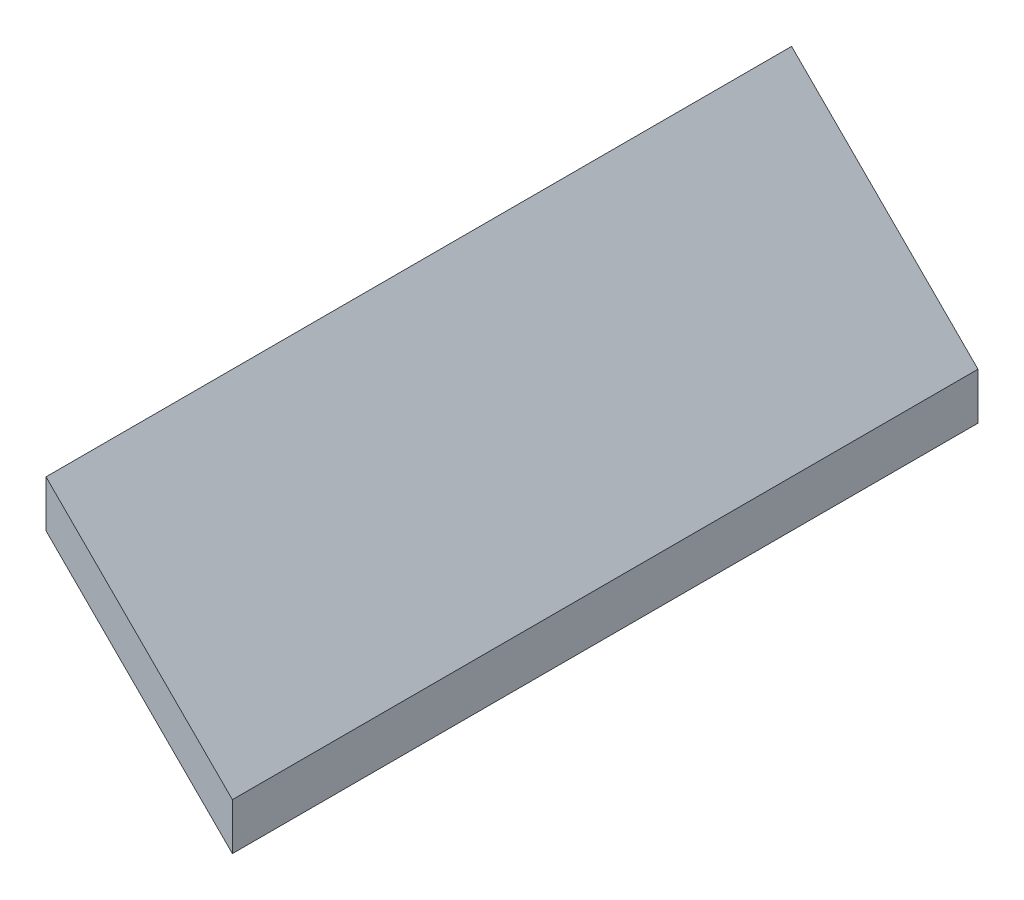
from build123d import *

# Parameters (mm, degrees)
BOSS_EXTRUDE1_DEPTH = 76.2


with BuildPart() as part:
    # Sketch2 → Boss-Extrude1 (new body)
    with BuildSketch(Plane.XY):
        Polygon((0, 0), (0, -4.7752), (19.05, -23.8252), (19.05, -19.05), align=None)
    extrude(amount=BOSS_EXTRUDE1_DEPTH)


solid = part.part
